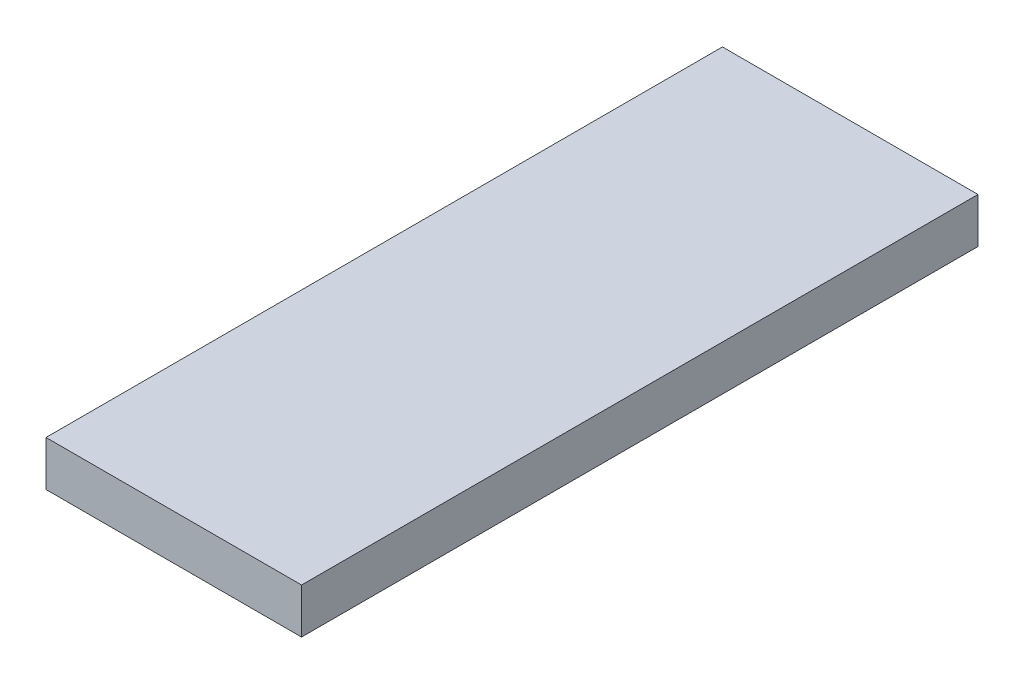
from build123d import *

# Parameters (mm, degrees)
SKETCH1_W           = 17
SKETCH1_H           = 45
BOSS_EXTRUDE1_DEPTH = 3


with BuildPart() as part:
    # Sketch1 → Boss-Extrude1 (new body)
    with BuildSketch(Plane(origin=(0, 0, 0), x_dir=(1, 0, 0), z_dir=(0, 1, 0))):
        Rectangle(SKETCH1_W, SKETCH1_H)
    extrude(amount=BOSS_EXTRUDE1_DEPTH)


solid = part.part
